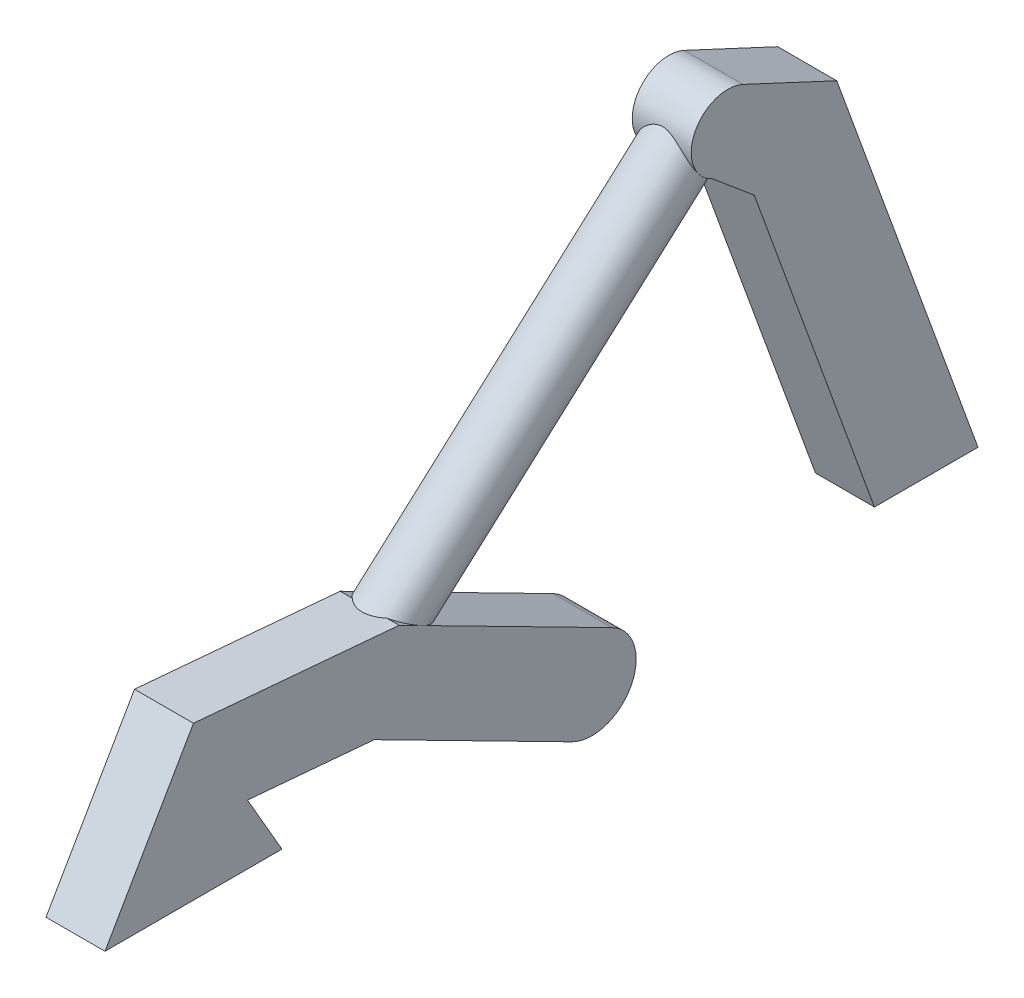
from build123d import *

# Parameters (mm, degrees)
EXTRUDE_1_DEPTH = 10


with BuildPart() as part:
    # 草图1 → 旋转1 (revolve)
    with BuildSketch(Plane(origin=(0, 0, 0), x_dir=(0, 0, -1), z_dir=(1, 0, 0))):
        Polygon((52.844000246, 127.679731381), (46.158922046, 135.116782508), (-69.478316775, 31.171822167), (-62.793238575, 23.73477104), align=None)
    revolve(axis=Axis((0, 135.116782508, -46.158922046), (0, -0.6685078200290915, 0.7437051126353456)))

    # 草图1<3> → 凸台-拉伸1 (add, symmetric)
    with BuildSketch(Plane(origin=(0, 0, 0), x_dir=(0, 0, -1), z_dir=(1, 0, 0))):
        with BuildLine():
            Line((95.882133508, 0), (131, 0))
            Line((131, 0), (83.117179934, 131.55696691))
            Line((83.117179934, 131.55696691), (51.396407388, 146.348606071))
            ThreePointArc((51.396407388, 146.348606071), (34.927098482, 140.35426785), (40.921436703, 123.884958945))
            Line((40.921436703, 123.884958945), (55.131576148, 111.961236177))
            Line((55.131576148, 111.961236177), (95.882133508, 0))
        make_face()
        with BuildLine():
            Line((6.905157326, 9.087391756), (-65.266371134, 45.860622235))
            Line((-65.266371134, 45.860622235), (-135, 51.961524227))
            Line((-135, 51.961524227), (-165, 0))
            Line((-165, 0), (-105, 0))
            Line((-105, 0), (-116.688381169, 20.244870042))
            Line((-116.688381169, 20.244870042), (-73.690262417, 16.483022099))
            Line((-73.690262417, 16.483022099), (-6.714557667, -17.64280397))
            ThreePointArc((-6.714557667, -17.64280397), (13.460397692, -11.087563603), (6.905157326, 9.087391756))
        make_face()
    extrude(amount=EXTRUDE_1_DEPTH, both=True)


solid = part.part
